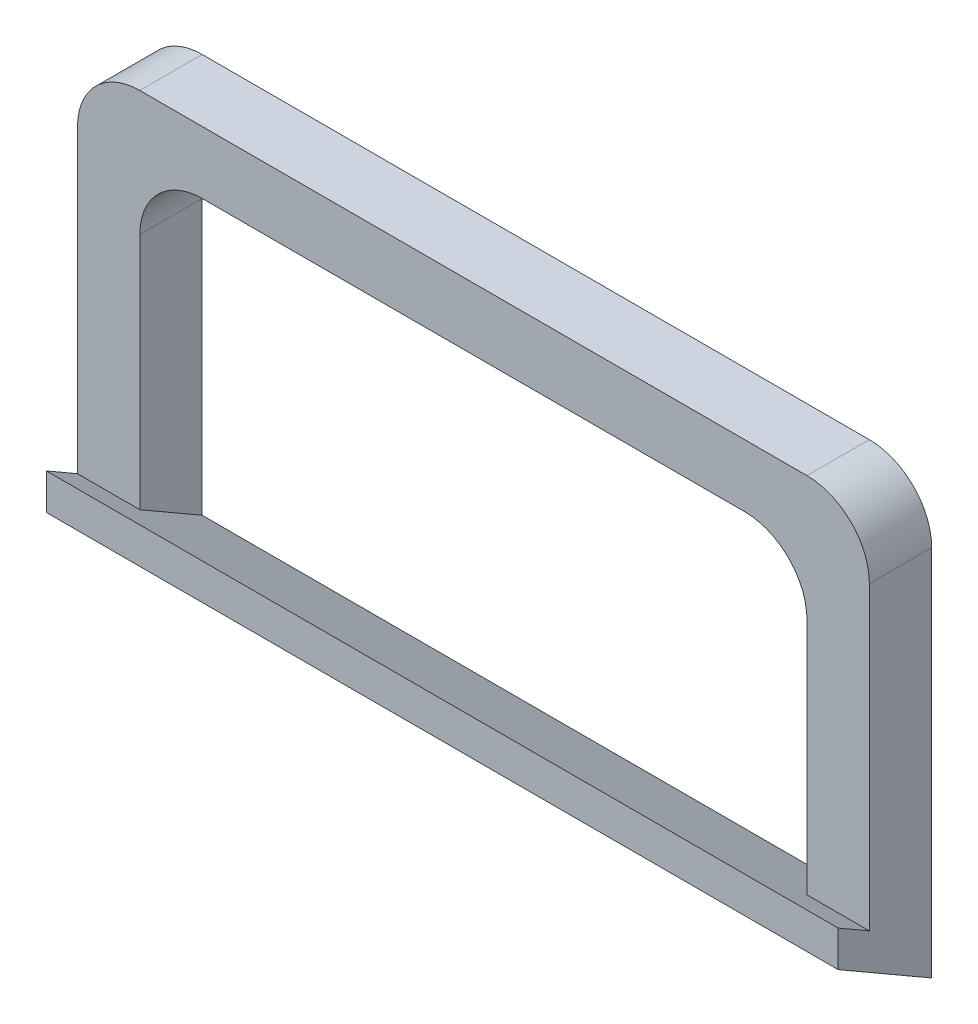
from build123d import *

# Parameters (mm, degrees)
SALIENTE_EXTRUIR1_DEPTH = 10
SALIENTE_EXTRUIR2_DEPTH = 127


with BuildPart() as part:
    # Croquis1 → Saliente-Extruir1 (new body)
    with BuildSketch(Plane.XY):
        with BuildLine():
            Line((-36.931162, -5.25170068), (-36.931162, 48.74829932))
            ThreePointArc((-36.931162, 48.74829932), (-34.002229812, 55.819367132), (-26.931162, 58.74829932))
            Line((-26.931162, 58.74829932), (80.068838, 58.74829932))
            ThreePointArc((80.068838, 58.74829932), (87.139905812, 55.819367132), (90.068838, 48.74829932))
            Line((90.068838, 48.74829932), (90.068838, -5.25170068))
            Line((90.068838, -5.25170068), (80.068838, -5.25170068))
            Line((80.068838, -5.25170068), (80.068838, 38.74829932))
            ThreePointArc((80.068838, 38.74829932), (77.139905812, 45.819367132), (70.068838, 48.74829932))
            Line((70.068838, 48.74829932), (-16.931162, 48.74829932))
            ThreePointArc((-16.931162, 48.74829932), (-24.002229812, 45.819367132), (-26.931162, 38.74829932))
            Line((-26.931162, 38.74829932), (-26.931162, -5.25170068))
            Line((-26.931162, -5.25170068), (-36.931162, -5.25170068))
        make_face()
    extrude(amount=SALIENTE_EXTRUIR1_DEPTH)

    # Croquis2 → Saliente-Extruir2 (add)
    with BuildSketch(Plane.ZY.offset(36.931162)):
        Polygon((0, -11.025203372), (15, -2.364949334), (15, 3.408553358), (0, -5.25170068), align=None)
    extrude(amount=-SALIENTE_EXTRUIR2_DEPTH)


solid = part.part
